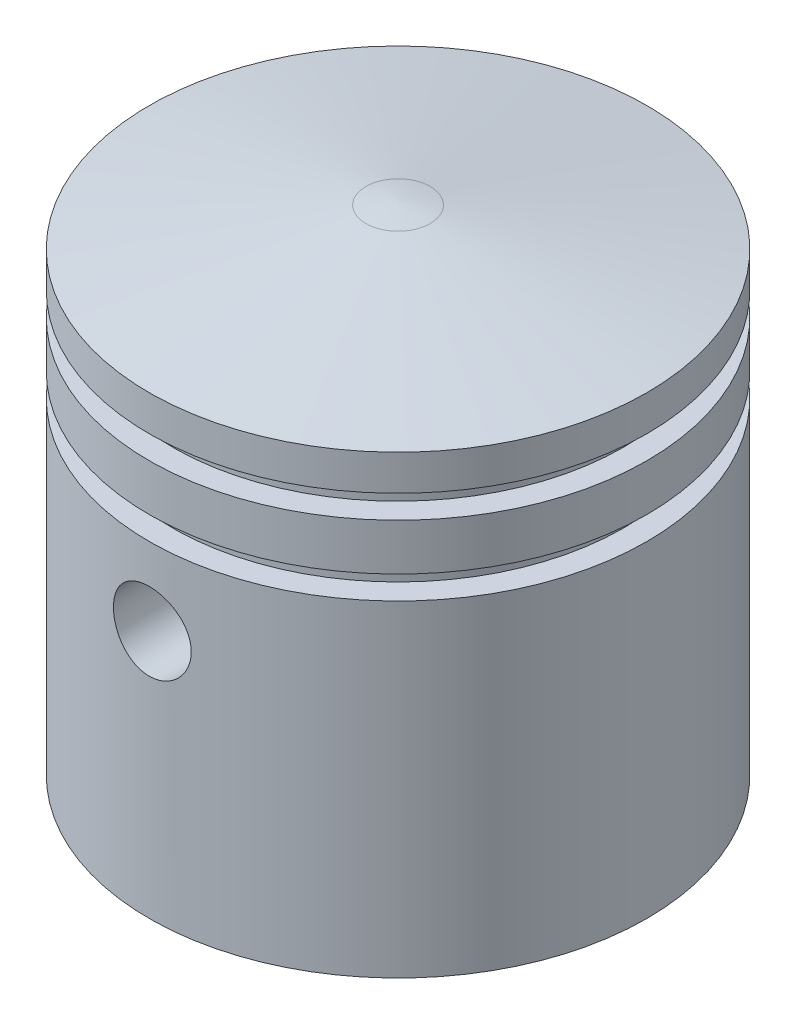
from build123d import *

# Parameters (mm, degrees)
CUT_EXTRUDE1_DEPTH      = 40.191835966
CUT_EXTRUDE1_DEPTH_BACK = 40.191835966
SKETCH3_R               = 2.5


with BuildPart() as part:
    # Sketch2 → Revolve1 (revolve)
    with BuildSketch(Plane.XY):
        with BuildLine():
            Line((16, 27), (14.5, 27))
            Line((14.5, 27), (14.5, 25.5))
            Line((14.5, 25.5), (16, 25.5))
            Line((16, 25.5), (16, 22.5))
            Line((16, 22.5), (14.5, 22.5))
            Line((14.5, 22.5), (14.5, 21))
            Line((14.5, 21), (16, 21))
            Line((16, 21), (16, 0))
            Line((16, 0), (13, 0))
            Line((13, 0), (13, 10))
            Line((13, 10), (10, 10))
            Line((10, 10), (10, 24))
            Line((10, 24), (0, 24))
            Line((0, 24), (0, 32))
            ThreePointArc((0, 32), (1.036981818, 31.899736945), (2.067335712, 31.745610948))
            Line((2.067335712, 31.745610948), (16, 29.288906321))
            Line((16, 29.288906321), (16, 27))
        make_face()
    revolve(axis=Axis((0, 0, 0), (0, 1, 0)))

    # Sketch3 → Cut-Extrude1 (cut, two sides: drawn at the far end of the back side and taken through both)
    with BuildSketch(Plane.XY.offset(-CUT_EXTRUDE1_DEPTH_BACK)):
        with Locations((0, 16)):
            Circle(SKETCH3_R)
    extrude(amount=CUT_EXTRUDE1_DEPTH + CUT_EXTRUDE1_DEPTH_BACK, mode=Mode.SUBTRACT)


solid = part.part
